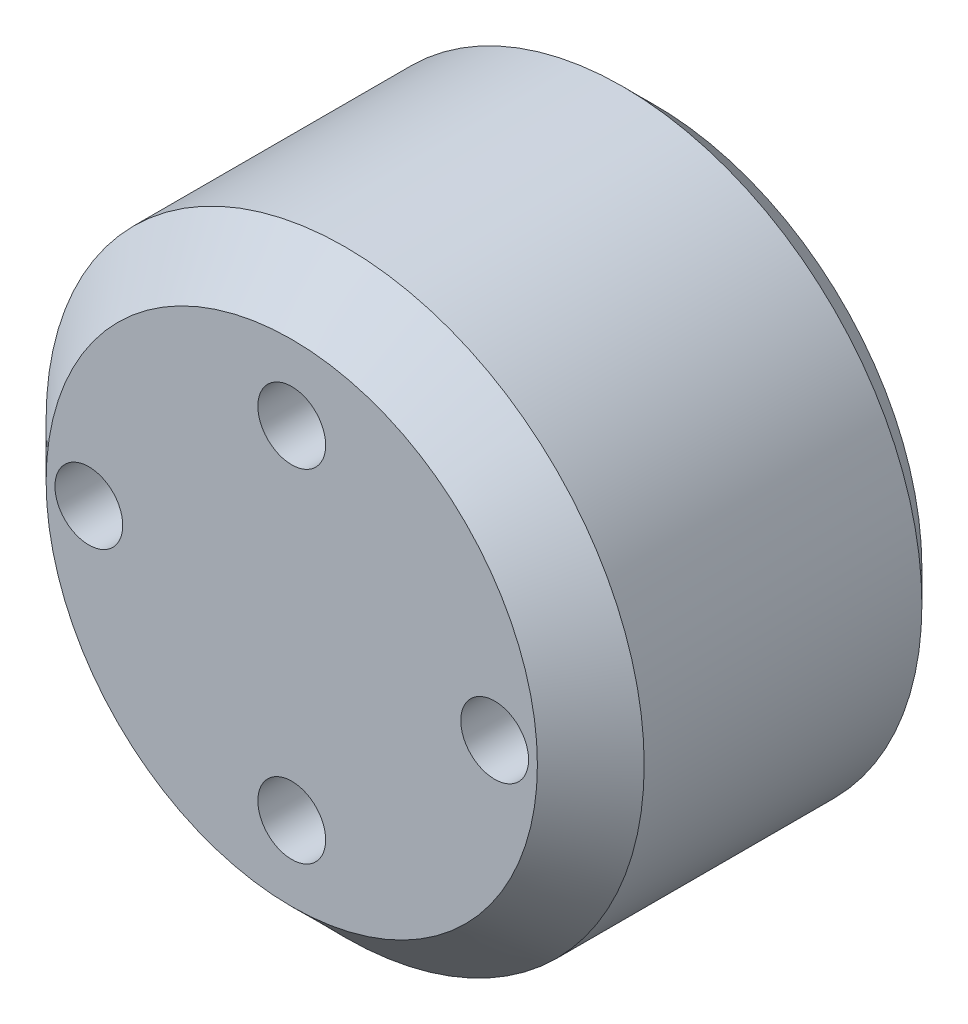
from build123d import *

# Parameters (mm, degrees)
SKETCH1_R           = 14
BOSS_EXTRUDE1_DEPTH = 17
SKETCH2_R           = 3
BOSS_EXTRUDE2_DEPTH = 5
SKETCH3_R           = 1.5875
CUT_EXTRUDE2_DEPTH  = 10
CHAMFER1_SIZE       = 1.5
CHAMFER2_SIZE       = 0.5
CHAMFER3_SIZE       = 2.5


with BuildPart() as part:
    # Sketch1 → Boss-Extrude1 (new body)
    with BuildSketch(Plane.XY):
        with Locations((-17.5533458, 7.425814207)):
            Circle(SKETCH1_R)
    extrude(amount=BOSS_EXTRUDE1_DEPTH)

    # Sketch2 → Boss-Extrude2 (add)
    with BuildSketch(Plane(origin=(0, -0.075436545, 0), x_dir=(-1, 0, 0), z_dir=(0, 0, -1))):
        with Locations((17.5533458, 7.501250752)):
            Circle(SKETCH2_R)
    extrude(amount=BOSS_EXTRUDE2_DEPTH)

    # Sketch3 → Cut-Extrude2 (cut)
    with BuildSketch(Plane.XY.offset(17)):
        with Locations((-17.5533458, 15.425814207)):
            Circle(SKETCH3_R)
        with Locations((-17.5533458, -0.574185793)):
            Circle(SKETCH3_R)
        with Locations((-27.0533458, 7.425814207)):
            Circle(SKETCH3_R)
        with Locations((-8.0533458, 7.425814207)):
            Circle(SKETCH3_R)
    extrude(amount=-CUT_EXTRUDE2_DEPTH, mode=Mode.SUBTRACT)

    # Chamfer1
    chamfer1_edges = [part.edges().sort_by_distance(p)[0] for p in [
        (-31.5533458, 7.425814207, 0),
    ]]
    chamfer(chamfer1_edges, length=CHAMFER1_SIZE)

    # Chamfer2
    chamfer2_edges = [part.edges().sort_by_distance(p)[0] for p in [
        (-14.5533458, 7.425814207, -5),
    ]]
    chamfer(chamfer2_edges, length=CHAMFER2_SIZE)

    # Chamfer3
    chamfer3_edges = [part.edges().sort_by_distance(p)[0] for p in [
        (-31.5533458, 7.425814207, 17),
    ]]
    chamfer(chamfer3_edges, length=CHAMFER3_SIZE)


solid = part.part
